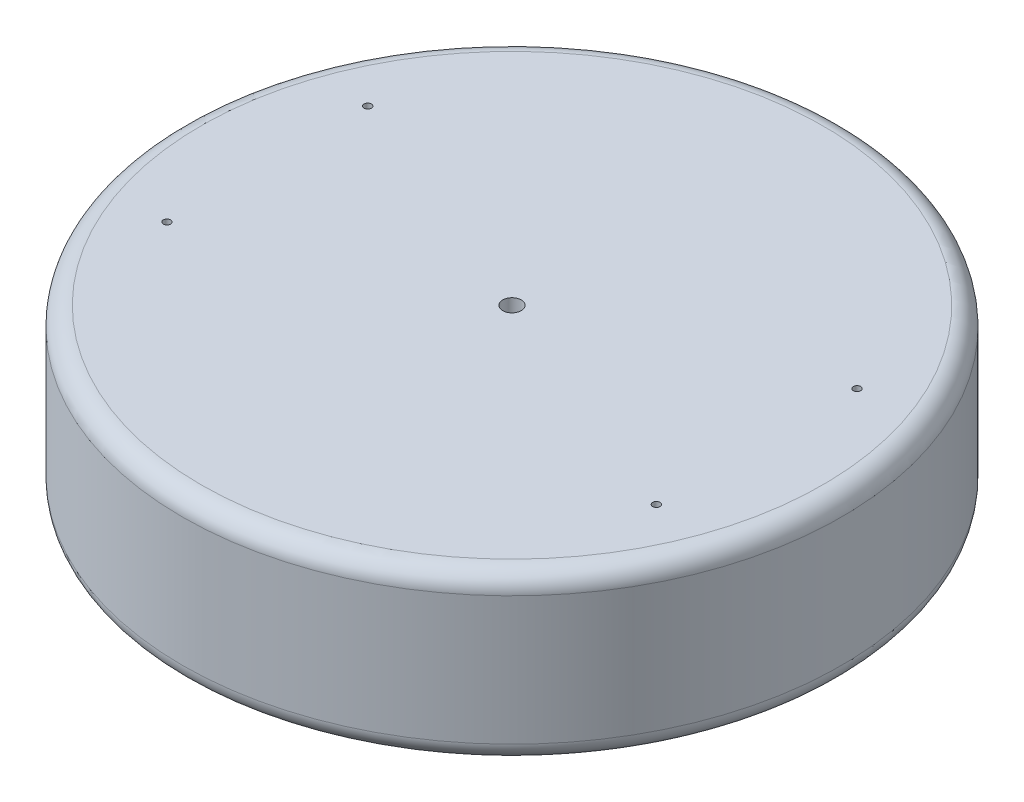
from build123d import *

# Parameters (mm, degrees)
SKETCH1_R           = 177
SKETCH1_R_2         = 5
BOSS_EXTRUDE1_DEPTH = 89
SKETCH2_R           = 1.975
CUT_EXTRUDE1_DEPTH  = 19
FILLET1_R           = 10


with BuildPart() as part:
    # Sketch1 → Boss-Extrude1 (new body)
    with BuildSketch(Plane(origin=(0, 0, 0), x_dir=(1, 0, 0), z_dir=(0, 1, 0))):
        with Locations(Location((0, 0, 0), (0, 0, 270))):
            Circle(SKETCH1_R)
        with Locations(Location((0, 0, 0), (0, 0, 270))):
            Circle(SKETCH1_R_2, mode=Mode.SUBTRACT)
    extrude(amount=BOSS_EXTRUDE1_DEPTH)

    # Sketch2 → Cut-Extrude1 (cut)
    with BuildSketch(Plane(origin=(0, 89, 0), x_dir=(1, 0, 0), z_dir=(0, 1, 0))):
        with Locations(Location((-131.4, 53.9, 0), (0, 0, 270))):
            Circle(SKETCH2_R)
        with Locations(Location((-131.4, -53.9, 0), (0, 0, 270))):
            Circle(SKETCH2_R)
        with Locations(Location((131.4, -53.9, 0), (0, 0, 90))):
            Circle(SKETCH2_R)
        with Locations(Location((131.4, 53.9, 0), (0, 0, 90))):
            Circle(SKETCH2_R)
    extrude(amount=-CUT_EXTRUDE1_DEPTH, mode=Mode.SUBTRACT)

    # Fillet1
    fillet1_edges = [part.edges().sort_by_distance(p)[0] for p in [
        (0, 0, -177),
        (0, 89, -177),
    ]]
    fillet(fillet1_edges, radius=FILLET1_R)


solid = part.part
